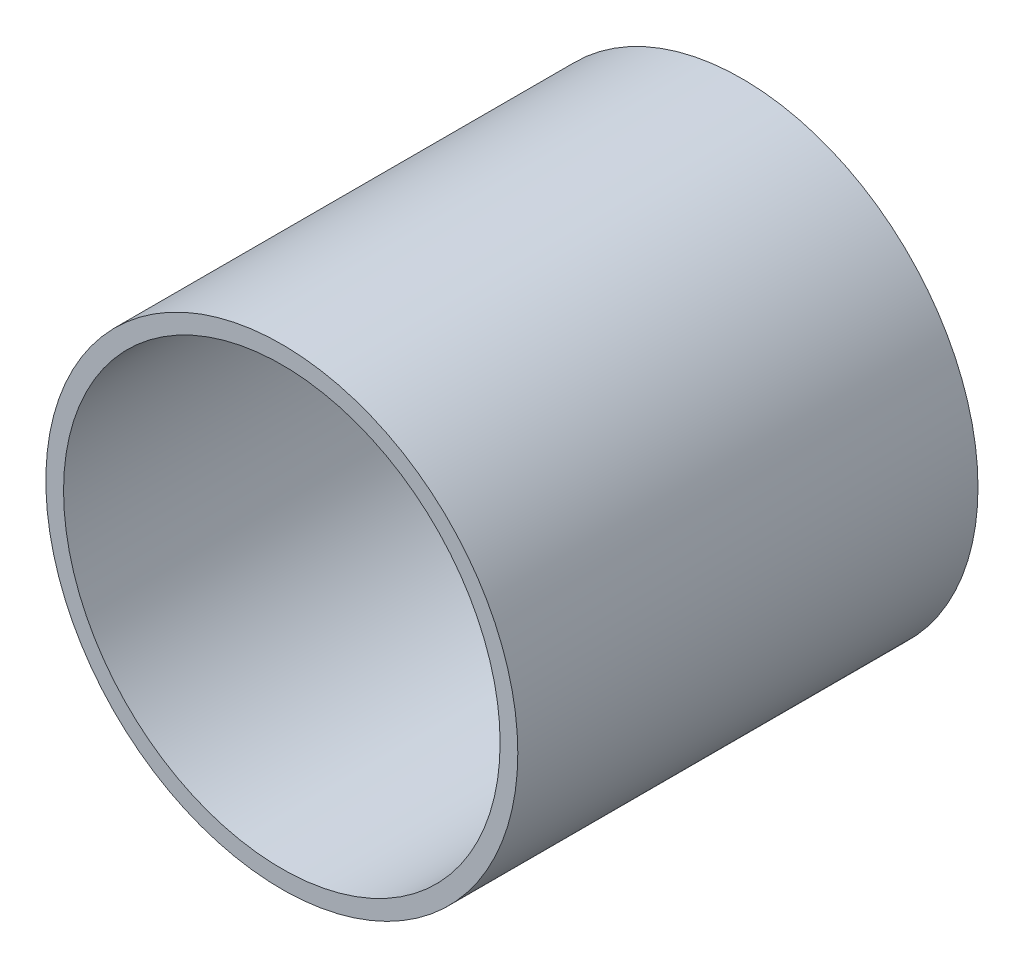
from build123d import *

# Parameters (mm, degrees)
SKETCH1_R           = 40
SKETCH1_R_2         = 37
BOSS_EXTRUDE1_DEPTH = 78


with BuildPart() as part:
    # Sketch1 → Boss-Extrude1 (new body)
    with BuildSketch(Plane.XY):
        Circle(SKETCH1_R)
        Circle(SKETCH1_R_2, mode=Mode.SUBTRACT)
    extrude(amount=BOSS_EXTRUDE1_DEPTH)


solid = part.part
